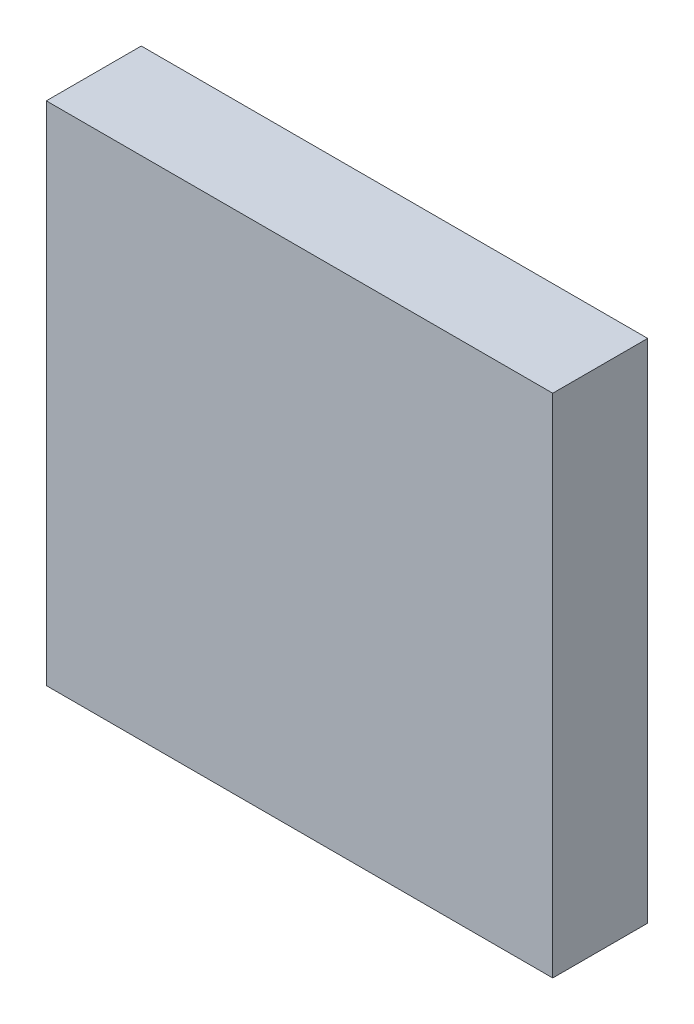
from build123d import *

# Parameters (mm, degrees)
SKETCH1_W           = 101.6
SKETCH1_H           = 101.6
BOSS_EXTRUDE1_DEPTH = 19.05


with BuildPart() as part:
    # Sketch1 → Boss-Extrude1 (new body)
    with BuildSketch(Plane.XY):
        with Locations((50.8, 50.8)):
            Rectangle(SKETCH1_W, SKETCH1_H)
    extrude(amount=BOSS_EXTRUDE1_DEPTH)


solid = part.part
